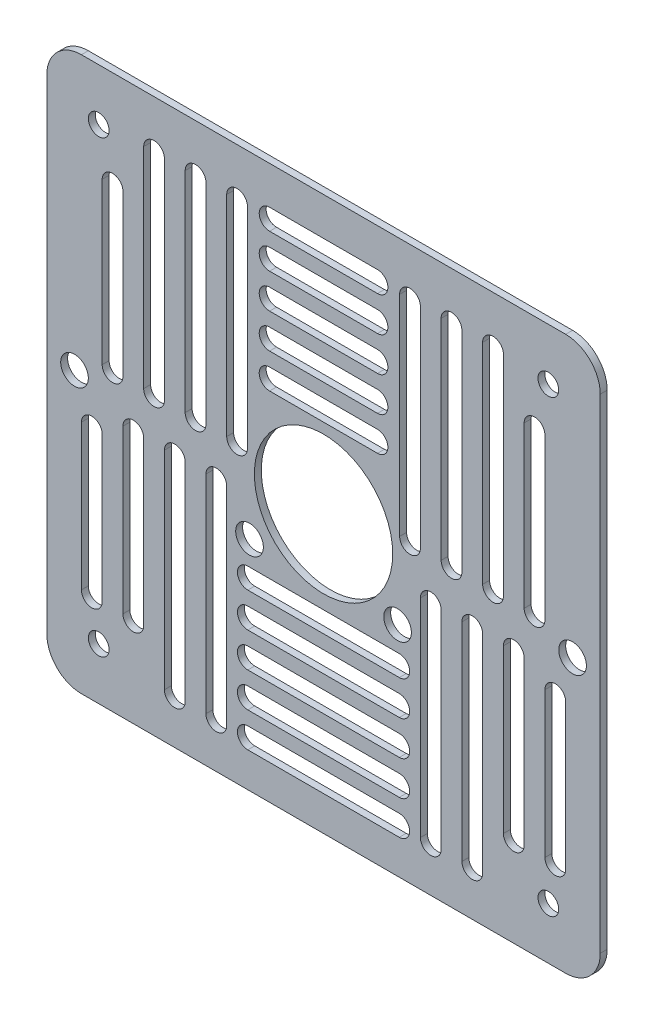
from build123d import *

# Parameters (mm, degrees)
CROQUIS1_R              = 10
SALIENTE_EXTRUIR1_DEPTH = 1
CROQUIS2_R              = 2
CROQUIS2_R_2            = 1.5
CORTAR_EXTRUIR1_DEPTH   = 1
CORTAR_EXTRUIR2_DEPTH   = 1
CORTAR_EXTRUIR3_DEPTH   = 1
CORTAR_EXTRUIR4_DEPTH   = 1


with BuildPart() as part:
    # Croquis1 → Saliente-Extruir1 (new body)
    with BuildSketch(Plane.XY):
        with BuildLine():
            Line((-35, -40), (35, -40))
            ThreePointArc((35, -40), (38.535533906, -38.535533906), (40, -35))
            Line((40, -35), (40, 35))
            ThreePointArc((40, 35), (38.535533906, 38.535533906), (35, 40))
            Line((35, 40), (-35, 40))
            ThreePointArc((-35, 40), (-38.535533906, 38.535533906), (-40, 35))
            Line((-40, 35), (-40, -35))
            ThreePointArc((-40, -35), (-38.535533906, -38.535533906), (-35, -40))
        make_face()
        Circle(CROQUIS1_R, mode=Mode.SUBTRACT)
    extrude(amount=-SALIENTE_EXTRUIR1_DEPTH)

    # Croquis2 → Cortar-Extruir1 (cut)
    with BuildSketch(Plane.XY):
        with Locations((36, 0)):
            Circle(CROQUIS2_R)
        with Locations(Location((-36, 0, 0), (0, 0, 180))):
            Circle(CROQUIS2_R)
        with Locations((32.5, -32.5)):
            Circle(CROQUIS2_R_2)
        with Locations(Location((32.5, 32.5, 0), (0, 0, 180))):
            Circle(CROQUIS2_R_2)
        with Locations(Location((-32.5, -32.5, 0), (0, 0, 180))):
            Circle(CROQUIS2_R_2)
        with Locations((-32.5, 32.5)):
            Circle(CROQUIS2_R_2)
        with Locations((10.7, -8.5)):
            Circle(CROQUIS2_R)
        with Locations(Location((-10.7, -8.5, 0), (0, 0, 180))):
            Circle(CROQUIS2_R)
    extrude(amount=-CORTAR_EXTRUIR1_DEPTH, mode=Mode.SUBTRACT)

    # Croquis3 → Cortar-Extruir2 (cut)
    with BuildSketch(Plane.XY):
        with BuildLine():
            Line((-7.8, 26.5), (7.8, 26.5))
            ThreePointArc((7.8, 26.5), (9.3, 28), (7.8, 29.5))
            Line((7.8, 29.5), (-7.8, 29.5))
            ThreePointArc((-7.8, 29.5), (-9.3, 28), (-7.8, 26.5))
        make_face()
        with BuildLine():
            Line((-7.8, 34.5), (7.8, 34.5))
            ThreePointArc((7.8, 34.5), (9.3, 33), (7.8, 31.5))
            Line((7.8, 31.5), (-7.8, 31.5))
            ThreePointArc((-7.8, 31.5), (-9.3, 33), (-7.8, 34.5))
        make_face()
        with BuildLine():
            Line((-7.8, 21.5), (7.8, 21.5))
            ThreePointArc((7.8, 21.5), (9.3, 23), (7.8, 24.5))
            Line((7.8, 24.5), (-7.8, 24.5))
            ThreePointArc((-7.8, 24.5), (-9.3, 23), (-7.8, 21.5))
        make_face()
        with BuildLine():
            Line((-7.8, 16.5), (7.8, 16.5))
            ThreePointArc((7.8, 16.5), (9.3, 18), (7.8, 19.5))
            Line((7.8, 19.5), (-7.8, 19.5))
            ThreePointArc((-7.8, 19.5), (-9.3, 18), (-7.8, 16.5))
        make_face()
        with BuildLine():
            Line((-7.8, 11.5), (7.8, 11.5))
            ThreePointArc((7.8, 11.5), (9.3, 13), (7.8, 14.5))
            Line((7.8, 14.5), (-7.8, 14.5))
            ThreePointArc((-7.8, 14.5), (-9.3, 13), (-7.8, 11.5))
        make_face()
        with BuildLine():
            Line((-10.95, -30), (10.95, -30))
            ThreePointArc((10.95, -30), (12.45, -28.5), (10.95, -27))
            Line((10.95, -27), (-10.95, -27))
            ThreePointArc((-10.95, -27), (-12.45, -28.5), (-10.95, -30))
        make_face()
        with BuildLine():
            Line((-10.95, -32), (10.95, -32))
            ThreePointArc((10.95, -32), (12.45, -33.5), (10.95, -35))
            Line((10.95, -35), (-10.95, -35))
            ThreePointArc((-10.95, -35), (-12.45, -33.5), (-10.95, -32))
        make_face()
        with BuildLine():
            Line((-10.95, -25), (10.95, -25))
            ThreePointArc((10.95, -25), (12.45, -23.5), (10.95, -22))
            Line((10.95, -22), (-10.95, -22))
            ThreePointArc((-10.95, -22), (-12.45, -23.5), (-10.95, -25))
        make_face()
        with BuildLine():
            Line((-10.95, -20), (10.95, -20))
            ThreePointArc((10.95, -20), (12.45, -18.5), (10.95, -17))
            Line((10.95, -17), (-10.95, -17))
            ThreePointArc((-10.95, -17), (-12.45, -18.5), (-10.95, -20))
        make_face()
        with BuildLine():
            Line((-10.95, -15), (10.95, -15))
            ThreePointArc((10.95, -15), (12.45, -13.5), (10.95, -12))
            Line((10.95, -12), (-10.95, -12))
            ThreePointArc((-10.95, -12), (-12.45, -13.5), (-10.95, -15))
        make_face()
    extrude(amount=-CORTAR_EXTRUIR2_DEPTH, mode=Mode.SUBTRACT)

    # Croquis4 → Cortar-Extruir3 (cut)
    with BuildSketch(Plane.XY):
        with BuildLine():
            Line((11, 2.7), (11, 33))
            ThreePointArc((11, 33), (12.5, 34.5), (14, 33))
            Line((14, 33), (14, 2.7))
            ThreePointArc((14, 2.7), (12.5, 1.2), (11, 2.7))
        make_face()
        with BuildLine():
            Line((17, 2.7), (17, 33))
            ThreePointArc((17, 33), (18.5, 34.5), (20, 33))
            Line((20, 33), (20, 2.7))
            ThreePointArc((20, 2.7), (18.5, 1.2), (17, 2.7))
        make_face()
        with BuildLine():
            Line((23, 2.7), (23, 33))
            ThreePointArc((23, 33), (24.5, 34.5), (26, 33))
            Line((26, 33), (26, 2.7))
            ThreePointArc((26, 2.7), (24.5, 1.2), (23, 2.7))
        make_face()
        with BuildLine():
            Line((32, 25.9), (32, 2.7))
            ThreePointArc((32, 2.7), (30.5, 1.2), (29, 2.7))
            Line((29, 2.7), (29, 25.9))
            ThreePointArc((29, 25.9), (30.5, 27.4), (32, 25.9))
        make_face()
        with BuildLine():
            Line((-11, 2.7), (-11, 33))
            ThreePointArc((-11, 33), (-12.5, 34.5), (-14, 33))
            Line((-14, 33), (-14, 2.7))
            ThreePointArc((-14, 2.7), (-12.5, 1.2), (-11, 2.7))
        make_face()
        with BuildLine():
            Line((-17, 2.7), (-17, 33))
            ThreePointArc((-17, 33), (-18.5, 34.5), (-20, 33))
            Line((-20, 33), (-20, 2.7))
            ThreePointArc((-20, 2.7), (-18.5, 1.2), (-17, 2.7))
        make_face()
        with BuildLine():
            Line((-23, 2.7), (-23, 33))
            ThreePointArc((-23, 33), (-24.5, 34.5), (-26, 33))
            Line((-26, 33), (-26, 2.7))
            ThreePointArc((-26, 2.7), (-24.5, 1.2), (-23, 2.7))
        make_face()
        with BuildLine():
            Line((-32, 25.9), (-32, 2.7))
            ThreePointArc((-32, 2.7), (-30.5, 1.2), (-29, 2.7))
            Line((-29, 2.7), (-29, 25.9))
            ThreePointArc((-29, 25.9), (-30.5, 27.4), (-32, 25.9))
        make_face()
    extrude(amount=-CORTAR_EXTRUIR3_DEPTH, mode=Mode.SUBTRACT)

    # Croquis5 → Cortar-Extruir4 (cut)
    with BuildSketch(Plane.XY):
        with BuildLine():
            Line((17, -3.5), (17, -33.5))
            ThreePointArc((17, -33.5), (15.5, -35), (14, -33.5))
            Line((14, -33.5), (14, -3.5))
            ThreePointArc((14, -3.5), (15.5, -2), (17, -3.5))
        make_face()
        with BuildLine():
            Line((20, -3.5), (20, -33.5))
            ThreePointArc((20, -33.5), (21.5, -35), (23, -33.5))
            Line((23, -33.5), (23, -3.5))
            ThreePointArc((23, -3.5), (21.5, -2), (20, -3.5))
        make_face()
        with BuildLine():
            Line((29, -3.5), (29, -27))
            ThreePointArc((29, -27), (27.5, -28.5), (26, -27))
            Line((26, -27), (26, -3.5))
            ThreePointArc((26, -3.5), (27.5, -2), (29, -3.5))
        make_face()
        with BuildLine():
            Line((32, -27), (32, -6))
            ThreePointArc((32, -6), (33.5, -4.5), (35, -6))
            Line((35, -6), (35, -27))
            ThreePointArc((35, -27), (33.5, -28.5), (32, -27))
        make_face()
        with BuildLine():
            Line((-17, -3.5), (-17, -33.5))
            ThreePointArc((-17, -33.5), (-15.5, -35), (-14, -33.5))
            Line((-14, -33.5), (-14, -3.5))
            ThreePointArc((-14, -3.5), (-15.5, -2), (-17, -3.5))
        make_face()
        with BuildLine():
            Line((-23, -3.5), (-23, -33.5))
            ThreePointArc((-23, -33.5), (-21.5, -35), (-20, -33.5))
            Line((-20, -33.5), (-20, -3.5))
            ThreePointArc((-20, -3.5), (-21.5, -2), (-23, -3.5))
        make_face()
        with BuildLine():
            Line((-29, -3.5), (-29, -27))
            ThreePointArc((-29, -27), (-27.5, -28.5), (-26, -27))
            Line((-26, -27), (-26, -3.5))
            ThreePointArc((-26, -3.5), (-27.5, -2), (-29, -3.5))
        make_face()
        with BuildLine():
            Line((-32, -27), (-32, -6))
            ThreePointArc((-32, -6), (-33.5, -4.5), (-35, -6))
            Line((-35, -6), (-35, -27))
            ThreePointArc((-35, -27), (-33.5, -28.5), (-32, -27))
        make_face()
    extrude(amount=-CORTAR_EXTRUIR4_DEPTH, mode=Mode.SUBTRACT)


solid = part.part
